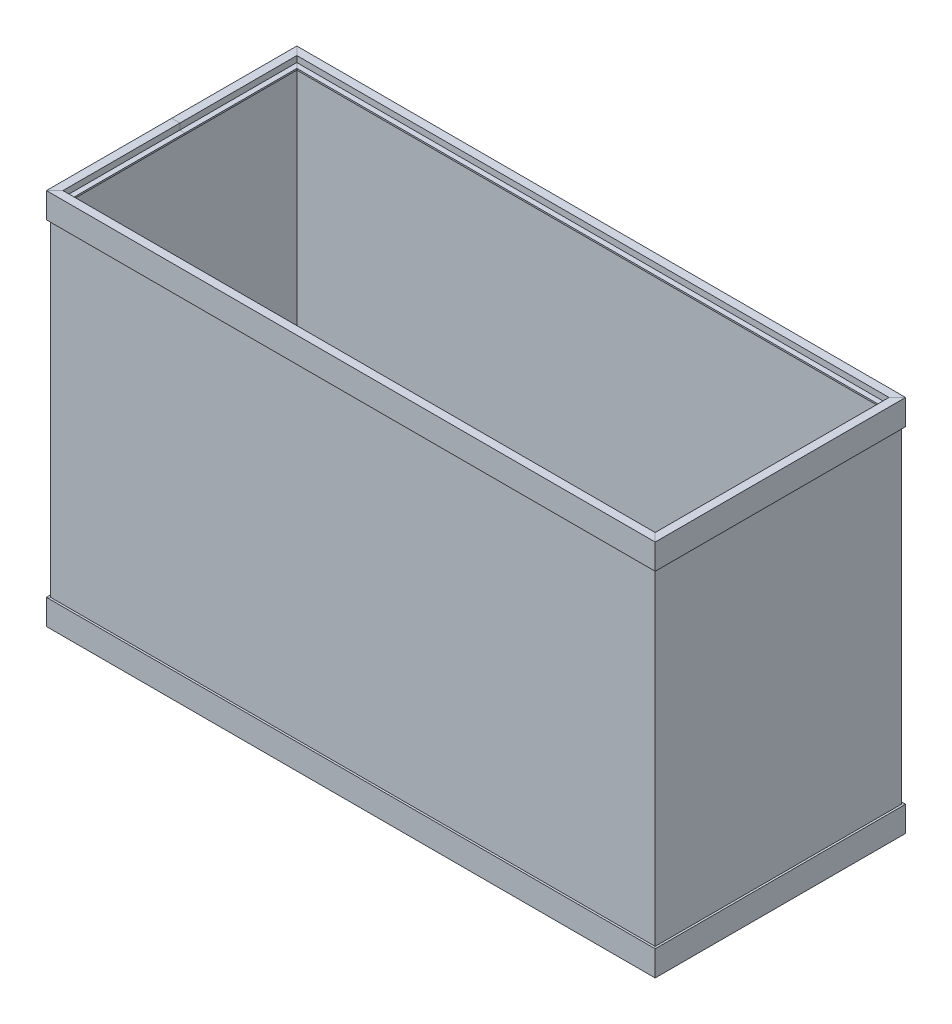
from build123d import *

# Parameters (mm, degrees)
SKETCH1_W        = 757.999999998
SKETCH1_H        = 308.8
SKETCH1_W_2      = 749.999999998
SKETCH1_H_2      = 300.8
TANK_WALLS_DEPTH = 461.2
SKETCH1_2_W      = 757.999999998
SKETCH1_2_H      = 308.8
TANK_FLOOR_DEPTH = 4


with BuildPart() as part:
    # Sketch1 → Tank Walls (new body)
    with BuildSketch(Plane(origin=(0, 0, 0), x_dir=(1, 0, 0), z_dir=(0, 1, 0))):
        Rectangle(SKETCH1_W, SKETCH1_H)
        Rectangle(SKETCH1_W_2, SKETCH1_H_2, mode=Mode.SUBTRACT)
    extrude(amount=TANK_WALLS_DEPTH)

    # Sketch1<2> → Tank Floor (add)
    with BuildSketch(Plane(origin=(0, 0, 0), x_dir=(1, 0, 0), z_dir=(0, 1, 0))):
        Rectangle(SKETCH1_2_W, SKETCH1_2_H)
    extrude(amount=TANK_FLOOR_DEPTH)


with BuildPart() as body_2:
    # Top Rim: sweep along a path in Sketch3
    with BuildLine(Plane(origin=(0, 461.2, 0), x_dir=(1, 0, 0), z_dir=(0, 1, 0))) as top_rim_path:
        Line((-378.999999999, -154.4), (378.999999999, -154.4))
        Line((378.999999999, -154.4), (378.999999999, 154.4))
        Line((378.999999999, 154.4), (-378.999999999, 154.4))
        Line((-378.999999999, 154.4), (-378.999999999, -154.4))
    # Sketch2 → Top Rim (sweep)
    with BuildSketch(Plane.XY):
        Polygon((-378.999999999, 461.2), (-364.839999999, 461.2), (-364.839999999, 463.105), (-371.189999999, 463.105), (-371.189999999, 470.725), (-381.539999999, 470.725), (-381.539999999, 438.975), (-378.999999999, 438.975), align=None)
    sweep(path=top_rim_path.line, transition=Transition.RIGHT)


with BuildPart() as body_3:
    # Bottom Rim: sweep along a path in Sketch5
    with BuildLine(Plane.XZ) as bottom_rim_path:
        Line((378.999999999, 154.4), (-378.999999999, 154.4))
        Line((-378.999999999, 154.4), (-378.999999999, -154.4))
        Line((-378.999999999, -154.4), (378.999999999, -154.4))
        Line((378.999999999, -154.4), (378.999999999, 154.4))
    # Sketch4 → Bottom Rim (sweep)
    with BuildSketch(Plane.XY):
        Polygon((-378.999999999, 0), (-378.999999999, 29.21), (-381.539999999, 29.21), (-381.539999999, -2.54), (-349.789999999, -2.54), (-349.789999999, 0), align=None)
    sweep(path=bottom_rim_path.line, transition=Transition.RIGHT)


solid = Compound([part.part, body_2.part, body_3.part])
